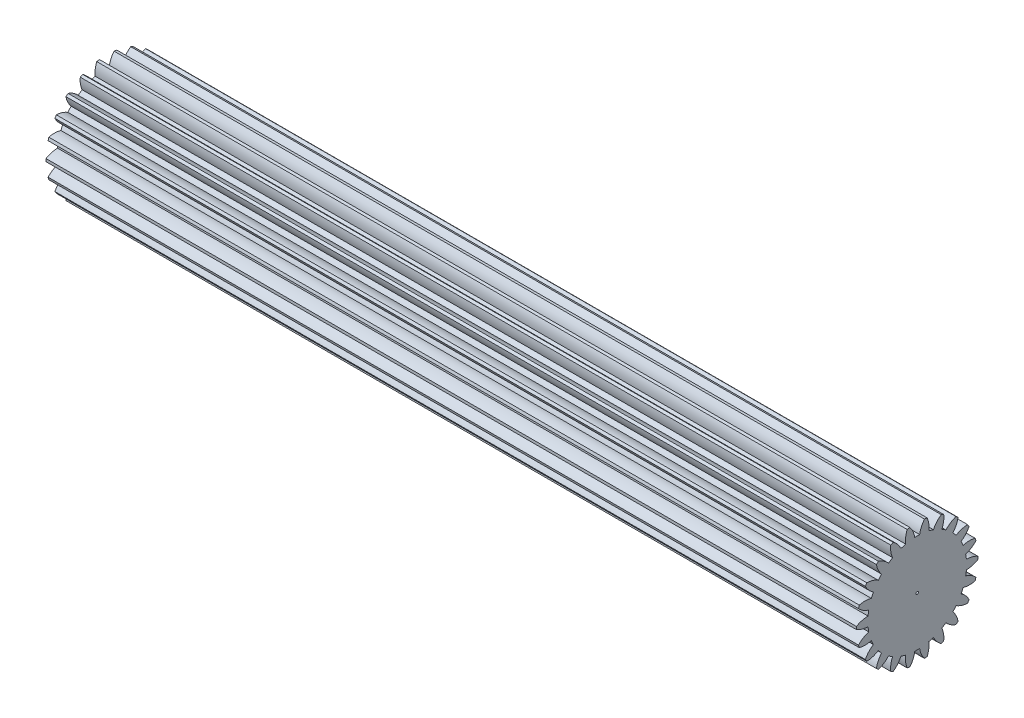
from build123d import *

# Parameters (mm, degrees)
BASPROSKE_W     = 254
BASPROSKE_H     = 19.05
TOOTHCUT_DEPTH  = 256.424754086
TEETHCUTS_COUNT = 22
TEETHCUTS_ANGLE = 343.636363636
BORSKE_R        = 0.396875
BORE_DEPTH      = 254.0000508


with BuildPart() as part:
    # BasProSke → Base-Revolve (revolve)
    with BuildSketch(Plane(origin=(0, 0, 0), x_dir=(1, 0, 0), z_dir=(0, 1, 0)), mode=Mode.PRIVATE) as base_revolve_sk:
        with Locations((127, 9.525)):
            Rectangle(BASPROSKE_W, BASPROSKE_H)
    revolve(base_revolve_sk.sketch.rotate(Axis((-10, 0, 0), (1, 0, 0)), 180), axis=Axis((-10, 0, 0), (1, 0, 0)))

    # TooCutSke → ToothCut (cut, through all)
    with BuildSketch(Plane(origin=(0, 0, 0), x_dir=(0, 0, -1), z_dir=(1, 0, 0))):
        with BuildLine():
            ThreePointArc((0.774580746, 15.457459861), (0, 15.476855), (-0.774580746, 15.457459861))
            ThreePointArc((-0.774580746, 15.457459861), (-1.297212804, 17.302561767), (-2.301915233, 18.935999351))
            ThreePointArc((-2.301915233, 18.935999351), (0, 19.0754), (2.301915233, 18.935999351))
            ThreePointArc((2.301915233, 18.935999351), (1.297212804, 17.302561767), (0.774580746, 15.457459861))
        make_face()
    toothcut = extrude(amount=TOOTHCUT_DEPTH, mode=Mode.SUBTRACT)

    # TeethCuts: ToothCut ×22 about axis
    teethcuts_axis = Axis((-10, 0, 0), (1, 0, 0))
    for i in range(1, TEETHCUTS_COUNT):
        add(toothcut.rotate(teethcuts_axis, i * TEETHCUTS_ANGLE / (TEETHCUTS_COUNT - 1)), mode=Mode.SUBTRACT)

    # BorSke → Bore (cut, symmetric)
    with BuildSketch(Plane(origin=(0, 0, 0), x_dir=(0, 0, -1), z_dir=(1, 0, 0))):
        with Locations(Location((0, 0, 0), (0, 0, 180))):
            Circle(BORSKE_R)
    extrude(amount=BORE_DEPTH, both=True, mode=Mode.SUBTRACT)


solid = part.part
